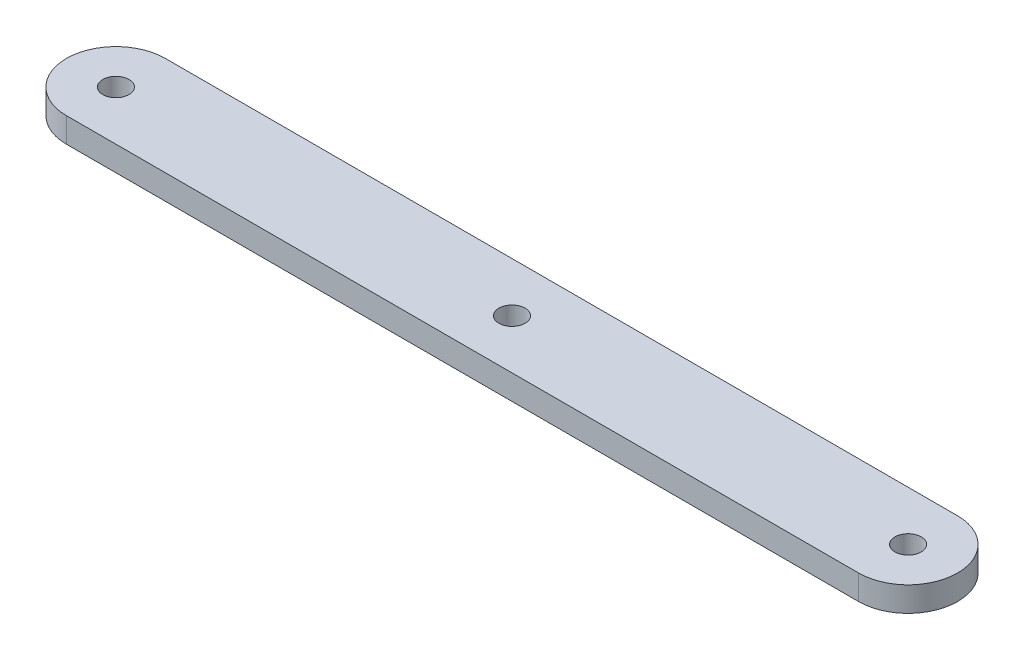
from build123d import *

# Parameters (mm, degrees)
SKETCH1_R           = 3.3655
BOSS_EXTRUDE1_DEPTH = 6.35


with BuildPart() as part:
    # Sketch1 → Boss-Extrude1 (new body)
    with BuildSketch(Plane(origin=(0, 0, 0), x_dir=(1, 0, 0), z_dir=(0, 1, 0))):
        with BuildLine():
            Line((-101.6, 12.7), (101.6, 12.7))
            ThreePointArc((101.6, 12.7), (114.3, 0), (101.6, -12.7))
            Line((101.6, -12.7), (-101.6, -12.7))
            ThreePointArc((-101.6, -12.7), (-114.3, 0), (-101.6, 12.7))
        make_face()
        with Locations(Location((101.6, 0, 0), (0, 0, 270))):
            Circle(SKETCH1_R, mode=Mode.SUBTRACT)
        with Locations(Location((-101.6, 0, 0), (0, 0, 270))):
            Circle(SKETCH1_R, mode=Mode.SUBTRACT)
        with Locations(Location((0, 0, 0), (0, 0, 270))):
            Circle(SKETCH1_R, mode=Mode.SUBTRACT)
    extrude(amount=BOSS_EXTRUDE1_DEPTH)


solid = part.part
